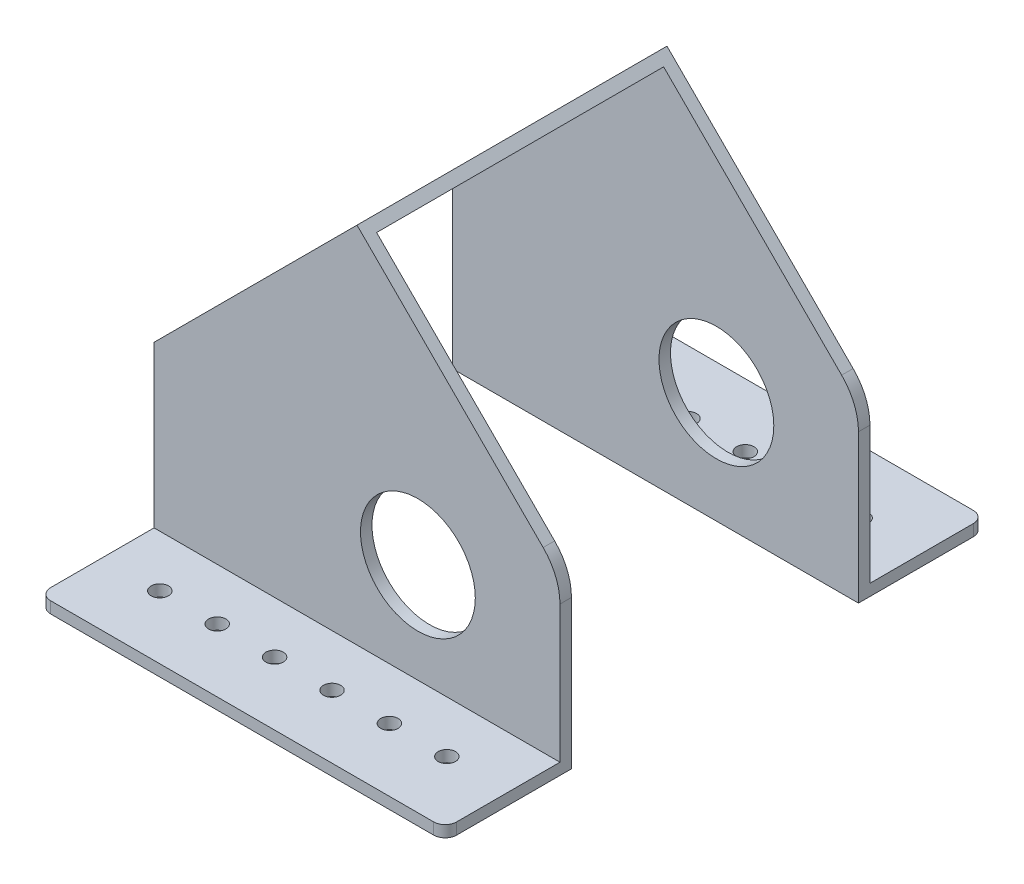
from build123d import *

# Parameters (mm, degrees)
SKETCH_1_R      = 10
EXTRUDE_1_DEPTH = 2
SKETCH_2_W      = 50
SKETCH_2_H      = 50
SKETCH_2_R      = 11.5
SKETCH_2_R_2    = 1.51
EXTRUDE_2_DEPTH = 2
SKETCH_3_R      = 1.51
EXTRUDE_3_DEPTH = 2


with BuildPart() as part:
    # 草图1 → 凸台-拉伸1 (new body)
    with BuildSketch(Plane.XY):
        with BuildLine():
            Line((0, 0), (0, 30))
            Line((0, 30), (35.355339059, 65.355339059))
            Line((35.355339059, 65.355339059), (67.781745931, 32.928932188))
            ThreePointArc((67.781745931, 32.928932188), (69.949473444, 29.6846987), (70.710678119, 25.857864376))
            Line((70.710678119, 25.857864376), (70.710678119, 0))
            Line((70.710678119, 0), (0, 0))
        make_face()
        with Locations((45.961940777, 19.393398282)):
            Circle(SKETCH_1_R, mode=Mode.SUBTRACT)
    extrude_1 = extrude(amount=EXTRUDE_1_DEPTH)

    # 草图2 → 凸台-拉伸2 (add)
    with BuildSketch(Plane(origin=(-15, 15, 0), x_dir=(0, 0, 1), z_dir=(-0.7071067811865477, 0.7071067811865475, 0))):
        with Locations((-25, 46.213203436)):
            Rectangle(SKETCH_2_W, SKETCH_2_H)
        with Locations(Location((-25, 46.213203436, 0), (0, 0, 270))):
            Circle(SKETCH_2_R, mode=Mode.SUBTRACT)
        with Locations(Location((-40.5, 61.713203436, 0), (0, 0, 270))):
            Circle(SKETCH_2_R_2, mode=Mode.SUBTRACT)
        with Locations(Location((-9.5, 61.713203436, 0), (0, 0, 270))):
            Circle(SKETCH_2_R_2, mode=Mode.SUBTRACT)
        with Locations(Location((-9.5, 30.713203436, 0), (0, 0, 270))):
            Circle(SKETCH_2_R_2, mode=Mode.SUBTRACT)
        with Locations(Location((-40.5, 30.713203436, 0), (0, 0, 270))):
            Circle(SKETCH_2_R_2, mode=Mode.SUBTRACT)
    extrude(amount=-EXTRUDE_2_DEPTH)

    # 草图3 → 凸台-拉伸3 (add)
    with BuildSketch(Plane.XZ):
        with BuildLine():
            Line((0, 2), (0, 20))
            ThreePointArc((0, 20), (0.585786438, 21.414213562), (2, 22))
            Line((2, 22), (68.710678119, 22))
            ThreePointArc((68.710678119, 22), (70.124891681, 21.414213562), (70.710678119, 20))
            Line((70.710678119, 20), (70.710678119, 2))
            Line((70.710678119, 2), (0, 2))
        make_face()
        with Locations(Location((10, 11, 0), (0, 0, 270))):
            Circle(SKETCH_3_R, mode=Mode.SUBTRACT)
        with Locations(Location((20, 11, 0), (0, 0, 270))):
            Circle(SKETCH_3_R, mode=Mode.SUBTRACT)
        with Locations(Location((30, 11, 0), (0, 0, 270))):
            Circle(SKETCH_3_R, mode=Mode.SUBTRACT)
        with Locations(Location((40, 11, 0), (0, 0, 270))):
            Circle(SKETCH_3_R, mode=Mode.SUBTRACT)
        with Locations(Location((50, 11, 0), (0, 0, 270))):
            Circle(SKETCH_3_R, mode=Mode.SUBTRACT)
        with Locations(Location((60, 11, 0), (0, 0, 270))):
            Circle(SKETCH_3_R, mode=Mode.SUBTRACT)
    extrude_3 = extrude(amount=-EXTRUDE_3_DEPTH)

    # 镜向1: 凸台-拉伸1, 凸台-拉伸3 across plane
    add(extrude_1.mirror(Plane(origin=(0, 0, -25), x_dir=(1, 0, 0), z_dir=(0, 0, -1))))
    add(extrude_3.mirror(Plane(origin=(0, 0, -25), x_dir=(1, 0, 0), z_dir=(0, 0, -1))))


solid = part.part
